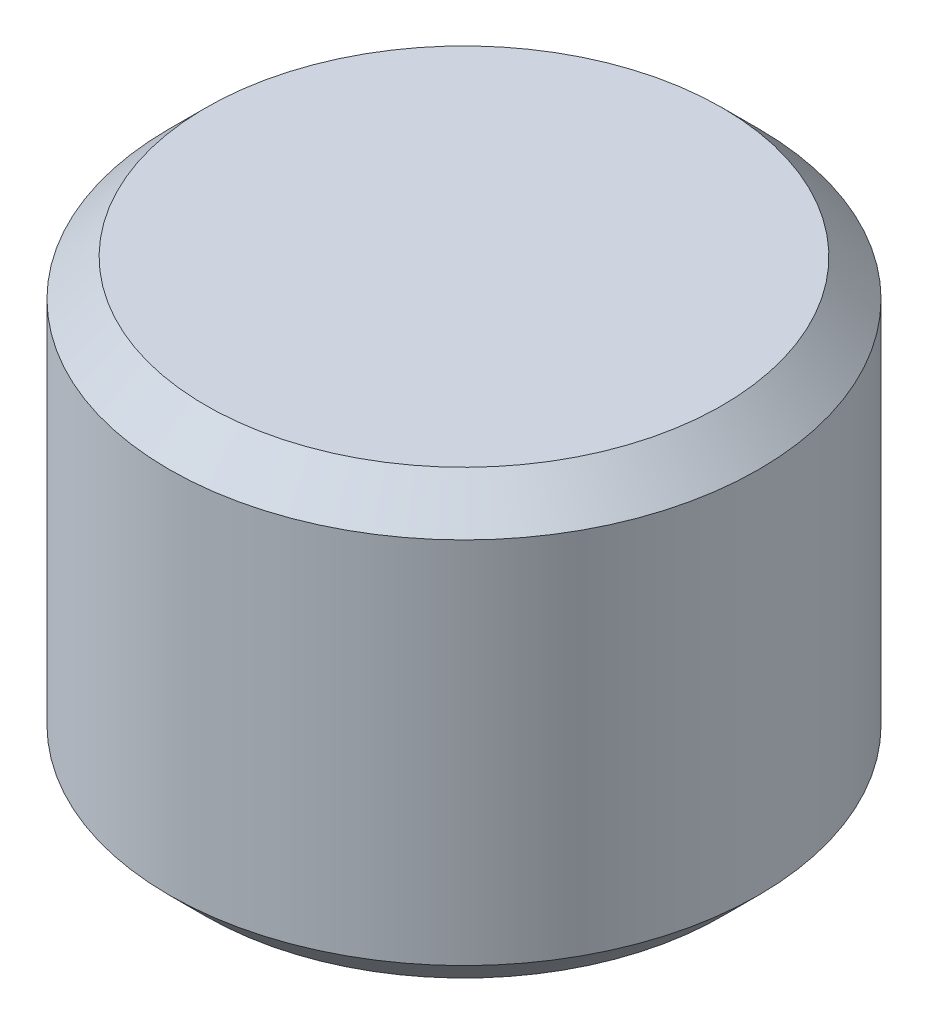
from build123d import *

# Parameters (mm, degrees)
CROQUIS1_W            = 4
CROQUIS1_H            = 6
CHAFL_N1_SIZE         = 0.5
CORTAR_EXTRUIR1_DEPTH = 4


with BuildPart() as part:
    # Croquis1 → Revolución1 (revolve)
    with BuildSketch(Plane.XY, mode=Mode.PRIVATE) as revoluci_n1_sk:
        with Locations((2, -3)):
            Rectangle(CROQUIS1_W, CROQUIS1_H)
    revolve(revoluci_n1_sk.sketch.rotate(Axis((0, 0, 0), (0, -1, 0)), 90), axis=Axis((0, 0, 0), (0, -1, 0)))

    # Chaflán1
    chafl_n1_edges = [part.edges().sort_by_distance(p)[0] for p in [
        (0, -6, -4),
        (0, 0, -4),
    ]]
    chamfer(chafl_n1_edges, length=CHAFL_N1_SIZE)

    # Croquis2 → Cortar-Extruir1 (cut)
    with BuildSketch(Plane.XZ.offset(6)):
        Polygon((-1.154700538, -2), (1.154700538, -2), (2.309401077, 0), (1.154700538, 2), (-1.154700538, 2), (-2.309401077, 0), align=None)
    extrude(amount=-CORTAR_EXTRUIR1_DEPTH, mode=Mode.SUBTRACT)


solid = part.part
